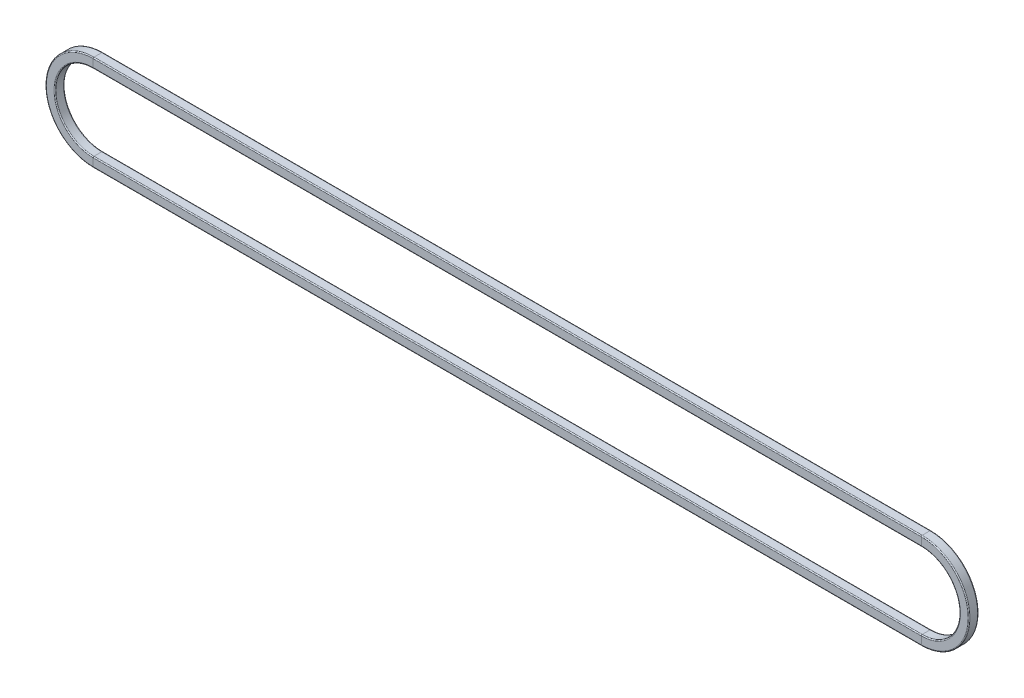
from build123d import *

# Parameters (mm, degrees)
SKETCH3_W    = 1
SKETCH3_H    = 1
SOFT_EDGES_R = 0.1


with BuildPart() as part:
    # rubber_band: sweep along a path in Sketch2
    with BuildLine(Plane.XY) as rubber_band_path:
        Line((0, 4.5), (86.8, 4.5))
        ThreePointArc((86.8, 4.5), (91.3, 0), (86.8, -4.5))
        Line((86.8, -4.5), (0, -4.5))
        ThreePointArc((0, -4.5), (-4.5, 0), (0, 4.5))
    # Sketch3 → rubber_band (sweep)
    with BuildSketch(Plane(origin=(0, 0, 0), x_dir=(0, 0, -1), z_dir=(1, 0, 0))):
        with Locations((0, 4.5)):
            Rectangle(SKETCH3_W, SKETCH3_H)
    sweep(path=rubber_band_path.line)

    # soft_edges
    soft_edges_edges = [part.edges().sort_by_distance(p)[0] for p in [
        (-5, 0, 0.5),
        (-4, 0, 0.5),
        (-4, 0, -0.5),
        (-5, 0, -0.5),
        (43.4, -5, 0.5),
        (43.4, -4, 0.5),
        (43.4, -4, -0.5),
        (43.4, -5, -0.5),
        (91.8, 0, 0.5),
        (90.8, 0, 0.5),
        (90.8, 0, -0.5),
        (91.8, 0, -0.5),
        (43.4, 5, 0.5),
        (43.4, 4, 0.5),
        (43.4, 4, -0.5),
        (43.4, 5, -0.5),
    ]]
    fillet(soft_edges_edges, radius=SOFT_EDGES_R)


solid = part.part
